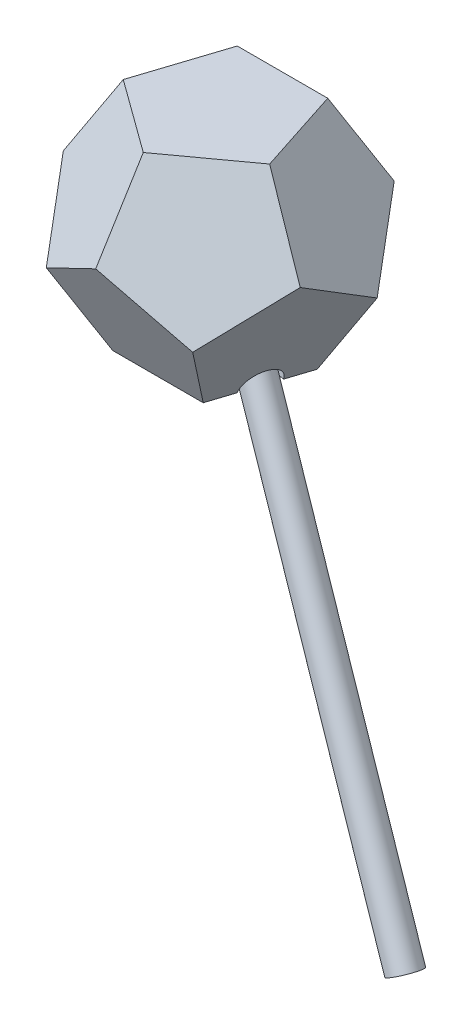
from build123d import *

# Parameters (mm, degrees)
BOSS_EXTRUDE1_DEPTH = 44.54
BOSS_EXTRUDE1_TAPER = -26.57
SKETCH2_OUTSIDE_W   = 156.308
SKETCH2_OUTSIDE_H   = 152.161
CUT_EXTRUDE1_DEPTH  = 44.54
CUT_EXTRUDE1_TAPER  = 26.57
SKETCH3_R           = 4.05
CUT_EXTRUDE2_DEPTH  = 35
SKETCH4_R           = 3.292788119
BOSS_EXTRUDE2_DEPTH = 130


with BuildPart() as part:
    # Sketch1 → Boss-Extrude1 (new body)
    with BuildSketch(Plane(origin=(0, 0, 0), x_dir=(1, 0, 0), z_dir=(0, 1, 0))):
        Polygon((0, 17.013016167), (-16.180339887, 5.257311121), (-10, -13.763819205), (10, -13.763819205), (16.180339887, 5.257311121), align=None)
    extrude(amount=BOSS_EXTRUDE1_DEPTH, taper=BOSS_EXTRUDE1_TAPER)

    # Sketch2 outside → Cut-Extrude1 (cut)
    with BuildSketch(Plane(origin=(0, 44.54, 0), x_dir=(1, 0, 0), z_dir=(0, 1, 0))):
        with Locations((0, 4.2535)):
            Rectangle(SKETCH2_OUTSIDE_W, SKETCH2_OUTSIDE_H)
        Polygon((0, -17.013016167), (16.180339887, -5.257311121), (10, 13.763819205), (-10, 13.763819205), (-16.180339887, -5.257311121), align=None, mode=Mode.SUBTRACT)
    extrude(amount=-CUT_EXTRUDE1_DEPTH, taper=CUT_EXTRUDE1_TAPER, mode=Mode.SUBTRACT)

    # Sketch3 → Cut-Extrude2 (cut)
    with BuildSketch(Plane(origin=(3.617528362, -6.155101222, 1.175406216), x_dir=(0.4408232334814932, 0.08851114782998275, -0.8932192639731522), z_dir=(0.49996506081853154, -0.8506735121122296, 0.16244849568822295))):
        with Locations(Location((1.971362597, 11.541364145, 0), (0, 0, 64.856110881))):
            Circle(SKETCH3_R)
    extrude(amount=-CUT_EXTRUDE2_DEPTH, mode=Mode.SUBTRACT)

    # Sketch4 → Boss-Extrude2 (add)
    with BuildSketch(Plane(origin=(-13.881248767, 23.618471702, -4.510291133), x_dir=(0.8660455749905556, 0.49109082304882484, -0.09378094452769076), z_dir=(0.49996506081853154, -0.8506735121122294, 0.16244849568822292))):
        with Locations(Location((10.937809574, 4.177759991, 0), (0, 0, 185.453817967))):
            Circle(SKETCH4_R)
    extrude(amount=BOSS_EXTRUDE2_DEPTH)


solid = part.part
